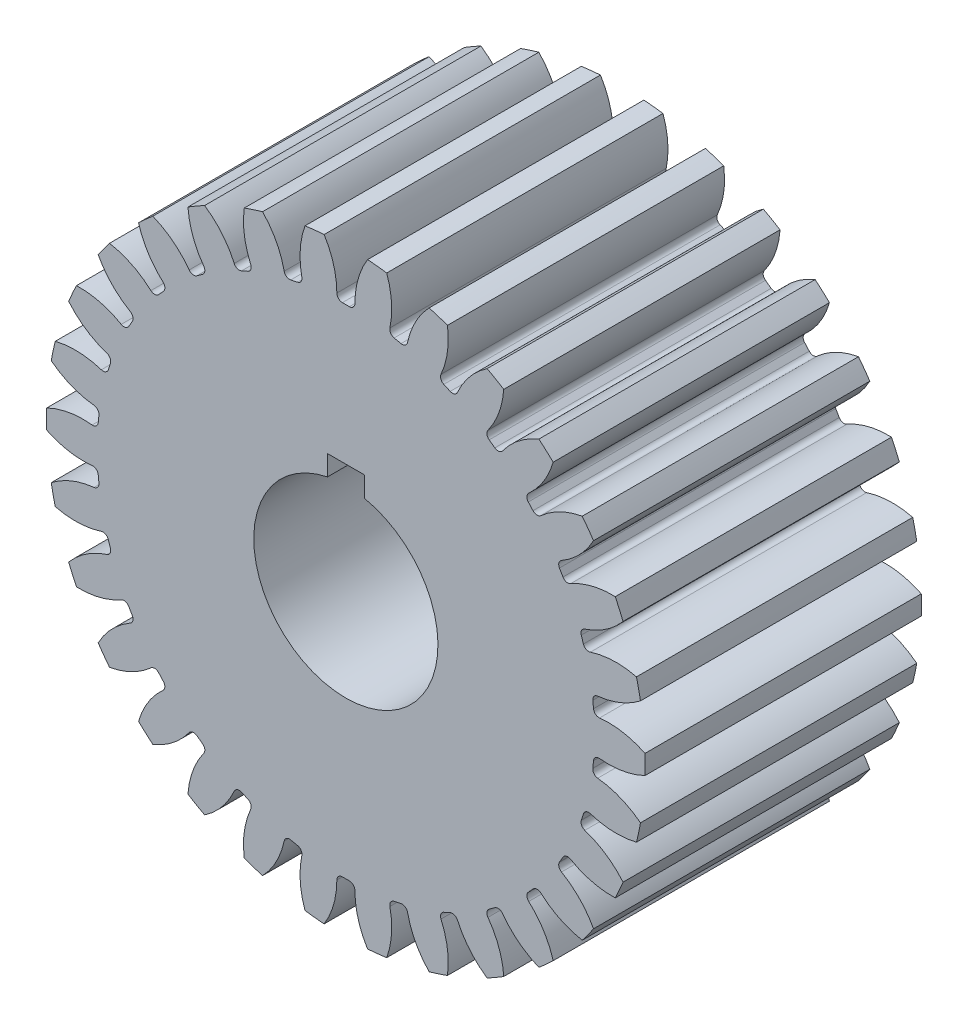
from build123d import *

# Parameters (mm, degrees)
SKETCH1_R           = 32.5
BOSS_EXTRUDE1_DEPTH = 15
CUT_EXTRUDE1_DEPTH  = 55.886246
SKETCH3_R           = 25
SKETCH3_R_2         = 15
CUT_EXTRUDE2_DEPTH  = 6
CUT_EXTRUDE3_DEPTH  = 55.886246
CIRPATTERN1_COUNT   = 30


with BuildPart() as part:
    # Sketch1 → Boss-Extrude1 (new, symmetric)
    with BuildSketch(Plane.XY):
        Circle(SKETCH1_R)
    extrude(amount=BOSS_EXTRUDE1_DEPTH, both=True)

    # Sketch2 → Cut-Extrude1 (cut, through all)
    with BuildSketch(Plane.XY.offset(15)):
        with BuildLine():
            Line((-2, 12), (2, 12))
            Line((2, 12), (2, 9.797958971))
            ThreePointArc((2, 9.797958971), (0, -10), (-2, 9.797958971))
            Line((-2, 9.797958971), (-2, 12))
        make_face()
    extrude(amount=-CUT_EXTRUDE1_DEPTH, mode=Mode.SUBTRACT)

    # Sketch3 → Cut-Extrude2 (cut)
    with BuildSketch(Plane(origin=(0, 0, -15), x_dir=(-1, 0, 0), z_dir=(0, 0, -1))):
        Circle(SKETCH3_R)
        Circle(SKETCH3_R_2, mode=Mode.SUBTRACT)
    extrude(amount=-CUT_EXTRUDE2_DEPTH, mode=Mode.SUBTRACT)

    # Sketch4 → Cut-Extrude3 (cut, symmetric)
    with BuildSketch(Plane(origin=(0, 0, -15), x_dir=(-1, 0, 0), z_dir=(0, 0, -1))):
        with BuildLine():
            Line((-0.380054542, 27), (0.380054542, 27))
            ThreePointArc((0.380054542, 27), (0.804366159, 27.175783485), (0.980054527, 27.600134496))
            ThreePointArc((0.980054527, 27.600134496), (1.539400833, 30.743390416), (3.15, 33.5))
            ThreePointArc((3.15, 33.5), (0, 33.186857557), (-3.15, 33.5))
            ThreePointArc((-3.15, 33.5), (-1.539400833, 30.743390416), (-0.980054527, 27.600134496))
            ThreePointArc((-0.980054527, 27.600134496), (-0.804366159, 27.175783485), (-0.380054542, 27))
        make_face()
    cut_extrude3 = extrude(amount=CUT_EXTRUDE3_DEPTH, both=True, mode=Mode.SUBTRACT)

    # CirPattern1: Cut-Extrude3 ×30 about axis
    cirpattern1_axis = Axis((0, 0, 0), (0, 0, 1))
    for i in range(1, CIRPATTERN1_COUNT):
        add(cut_extrude3.rotate(cirpattern1_axis, i * 360 / CIRPATTERN1_COUNT), mode=Mode.SUBTRACT)


solid = part.part
